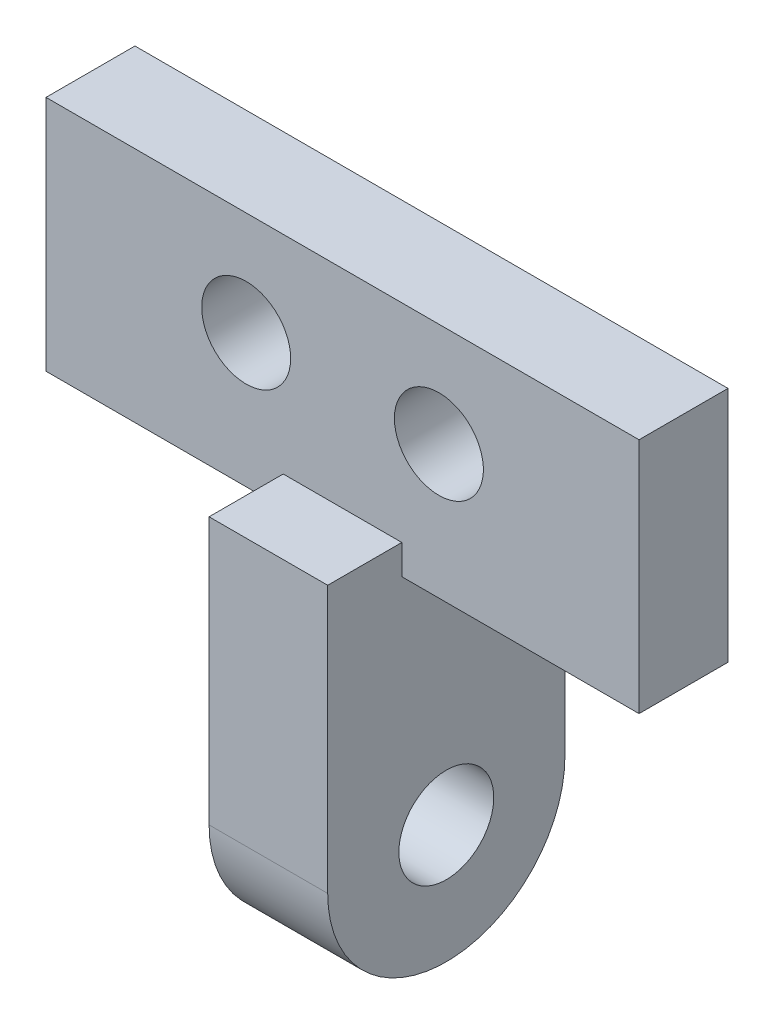
from build123d import *

# Parameters (mm, degrees)
SKETCH2_W           = 20
SKETCH2_H           = 8
SKETCH2_R           = 1.5
BOSS_EXTRUDE3_DEPTH = 3
BOSS_EXTRUDE4_START = -12
SKETCH5_R           = 1.6
BOSS_EXTRUDE4_DEPTH = 4


with BuildPart() as part:
    # Sketch2 → Boss-Extrude3 (new body)
    with BuildSketch(Plane.XY):
        with Locations((0, 4)):
            Rectangle(SKETCH2_W, SKETCH2_H)
        with Locations((-3.25, 4.5)):
            Circle(SKETCH2_R, mode=Mode.SUBTRACT)
        with Locations(Location((3.25, 4.5, 0), (0, 0, 180))):
            Circle(SKETCH2_R, mode=Mode.SUBTRACT)
    extrude(amount=BOSS_EXTRUDE3_DEPTH)

    # Sketch5 → Boss-Extrude4 (add)
    with BuildSketch(Plane(origin=(10, 0, 0), x_dir=(0, 0, -1), z_dir=(1, 0, 0)).offset(BOSS_EXTRUDE4_START)):
        with BuildLine():
            Line((-5.5, 0), (-5.5, -8))
            ThreePointArc((-5.5, -8), (-1.5, -12), (2.5, -8))
            Line((2.5, -8), (2.5, 0))
            Line((2.5, 0), (2.5, 1))
            Line((2.5, 1), (0, 1))
            Line((0, 1), (0, 0))
            Line((0, 0), (-3, 0))
            Line((-3, 0), (-3, 1))
            Line((-3, 1), (-5.5, 1))
            Line((-5.5, 1), (-5.5, 0))
        make_face()
        with Locations(Location((-1.5, -8, 0), (0, 0, 90))):
            Circle(SKETCH5_R, mode=Mode.SUBTRACT)
    extrude(amount=BOSS_EXTRUDE4_DEPTH)


solid = part.part
